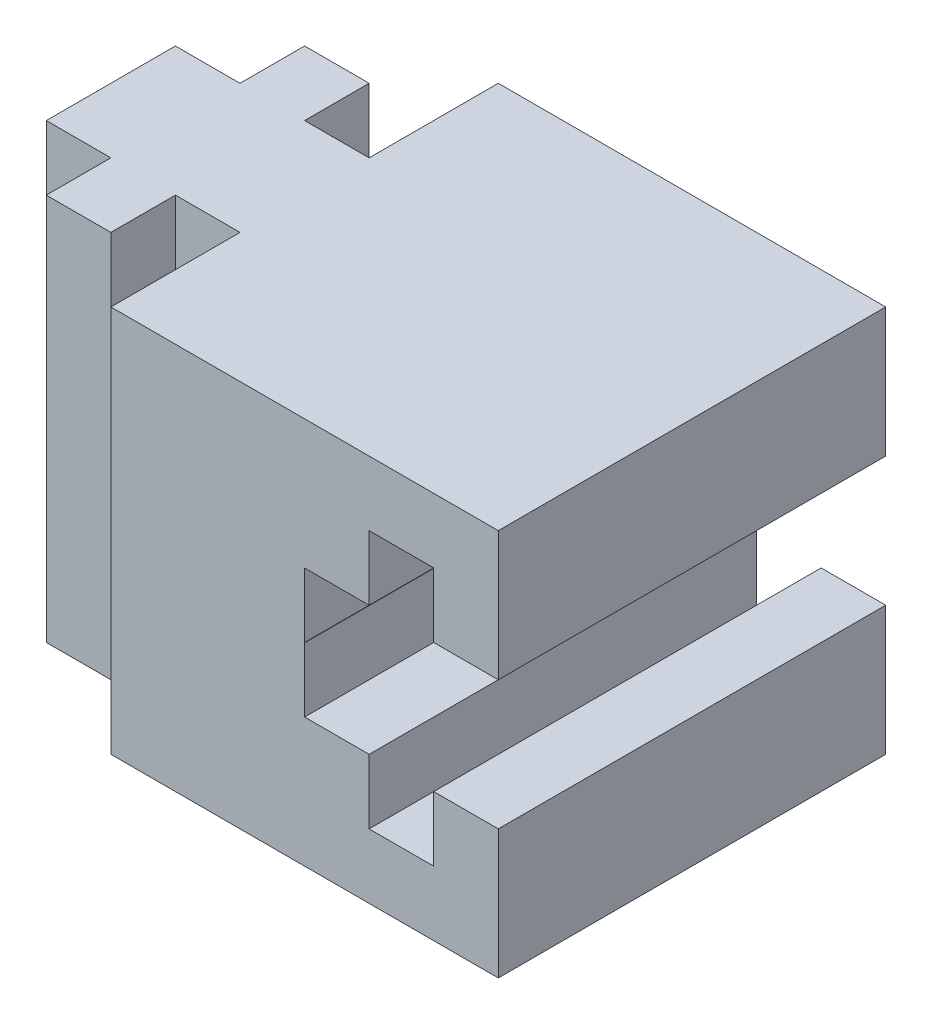
from build123d import *

# Parameters (mm, degrees)
SKETCH2_W           = 150
SKETCH2_H           = 150
BOSS_EXTRUDE1_DEPTH = 225
CUT_EXTRUDE1_DEPTH  = 150
CUT_EXTRUDE2_DEPTH  = 150


with BuildPart() as part:
    # Sketch2 → Boss-Extrude1 (new body)
    with BuildSketch(Plane(origin=(0, 0, 0), x_dir=(0, 0, -1), z_dir=(1, 0, 0))):
        Rectangle(SKETCH2_W, SKETCH2_H)
    extrude(amount=BOSS_EXTRUDE1_DEPTH)

    # Sketch3 → Cut-Extrude1 (cut)
    with BuildSketch(Plane(origin=(0, 75, 0), x_dir=(1, 0, 0), z_dir=(0, 1, 0))):
        Polygon((0, 75), (0, 25), (25, 25), (25, 50), (50, 50), (50, 25), (75, 25), (75, 75), align=None)
        Polygon((25, -25), (0, -25), (0, -75), (75, -75), (75, -25), (50, -25), (50, -50), (25, -50), align=None)
    extrude(amount=-CUT_EXTRUDE1_DEPTH, mode=Mode.SUBTRACT)

    # Sketch4 → Cut-Extrude2 (cut)
    with BuildSketch(Plane.XY.offset(75)):
        Polygon((225, 25), (200, 25), (200, 50), (175, 50), (175, 25), (150, 25), (150, 0), (149.856793805, 0), (149.856793805, -0.1270597), (150, -0.1270597), (150, -25), (175, -25), (175, -50), (200, -50), (200, -25), (225, -25), align=None)
    extrude(amount=-CUT_EXTRUDE2_DEPTH, mode=Mode.SUBTRACT)


solid = part.part
